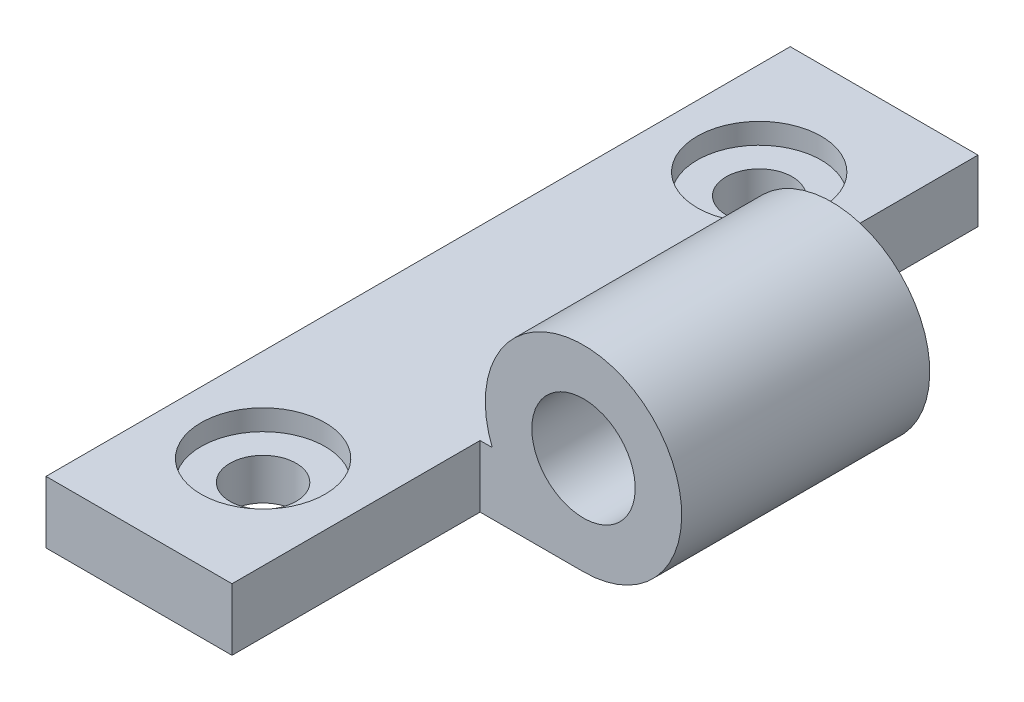
from build123d import *

# Parameters (mm, degrees)
SKETCH_1_W          = 14
SKETCH_1_H          = 36
EXTRUDE_1_DEPTH     = 3
SKETCH_6_R          = 1.6
CUT_EXTRUDE_3_DEPTH = 10
SKETCH_7_R          = 3
CUT_EXTRUDE_4_DEPTH = 1
SKETCH_9_R          = 4.75
EXTRUDE_2_DEPTH     = 12
SKETCH_10_R         = 2.5
CUT_EXTRUDE_5_DEPTH = 12
SKETCH_11_W         = 10.773254888
SKETCH_11_H         = 9.942175225
CUT_EXTRUDE_7_DEPTH = 12
SKETCH_12_W         = 10.083050504
SKETCH_12_H         = 5.143061972
CUT_EXTRUDE_8_DEPTH = 12


with BuildPart() as part:
    # 草图1 → 凸台-拉伸1 (new body)
    with BuildSketch(Plane(origin=(0, 0, 0), x_dir=(1, 0, 0), z_dir=(0, 1, 0))):
        with Locations((7, -18)):
            Rectangle(SKETCH_1_W, SKETCH_1_H)
    extrude(amount=EXTRUDE_1_DEPTH)

    # 草图6 → 切除-拉伸3 (cut)
    with BuildSketch(Plane(origin=(0, 3, 0), x_dir=(1, 0, 0), z_dir=(0, 1, 0))):
        with Locations(Location((4.5, -6, 0), (0, 0, 270))):
            Circle(SKETCH_6_R)
        with Locations(Location((4.5, -30, 0), (0, 0, 270))):
            Circle(SKETCH_6_R)
    extrude(amount=-CUT_EXTRUDE_3_DEPTH, mode=Mode.SUBTRACT)

    # 草图7 → 切除-拉伸4 (cut)
    with BuildSketch(Plane(origin=(0, 3, 0), x_dir=(1, 0, 0), z_dir=(0, 1, 0))):
        with Locations(Location((4.5, -6, 0), (0, 0, 270))):
            Circle(SKETCH_7_R)
        with Locations(Location((4.5, -30, 0), (0, 0, 270))):
            Circle(SKETCH_7_R)
    extrude(amount=-CUT_EXTRUDE_4_DEPTH, mode=Mode.SUBTRACT)

    # 草图9 → 凸台-拉伸2 (add)
    with BuildSketch(Plane(origin=(0, 0, 12), x_dir=(-1, 0, 0), z_dir=(0, 0, -1))):
        with Locations((-14, 4.75)):
            Circle(SKETCH_9_R)
    extrude(amount=-EXTRUDE_2_DEPTH)

    # 草图10 → 切除-拉伸5 (cut)
    with BuildSketch(Plane(origin=(0, 0, 12), x_dir=(-1, 0, 0), z_dir=(0, 0, -1))):
        with Locations(Location((-14, 4.75, 0), (0, 0, 315.572995999))):
            Circle(SKETCH_10_R)
    extrude(amount=-CUT_EXTRUDE_5_DEPTH, mode=Mode.SUBTRACT)

    # 草图11 → 切除-拉伸7 (cut)
    with BuildSketch(Plane(origin=(0, 0, 0), x_dir=(-1, 0, 0), z_dir=(0, 0, -1))):
        with Locations((-14.469441618, 3.035843785)):
            Rectangle(SKETCH_11_W, SKETCH_11_H)
    extrude(amount=-CUT_EXTRUDE_7_DEPTH, mode=Mode.SUBTRACT)

    # 草图12 → 切除-拉伸8 (cut)
    with BuildSketch(Plane.XY.offset(36)):
        with Locations((14.039079275, 2.038040722)):
            Rectangle(SKETCH_12_W, SKETCH_12_H)
    extrude(amount=-CUT_EXTRUDE_8_DEPTH, mode=Mode.SUBTRACT)


solid = part.part
